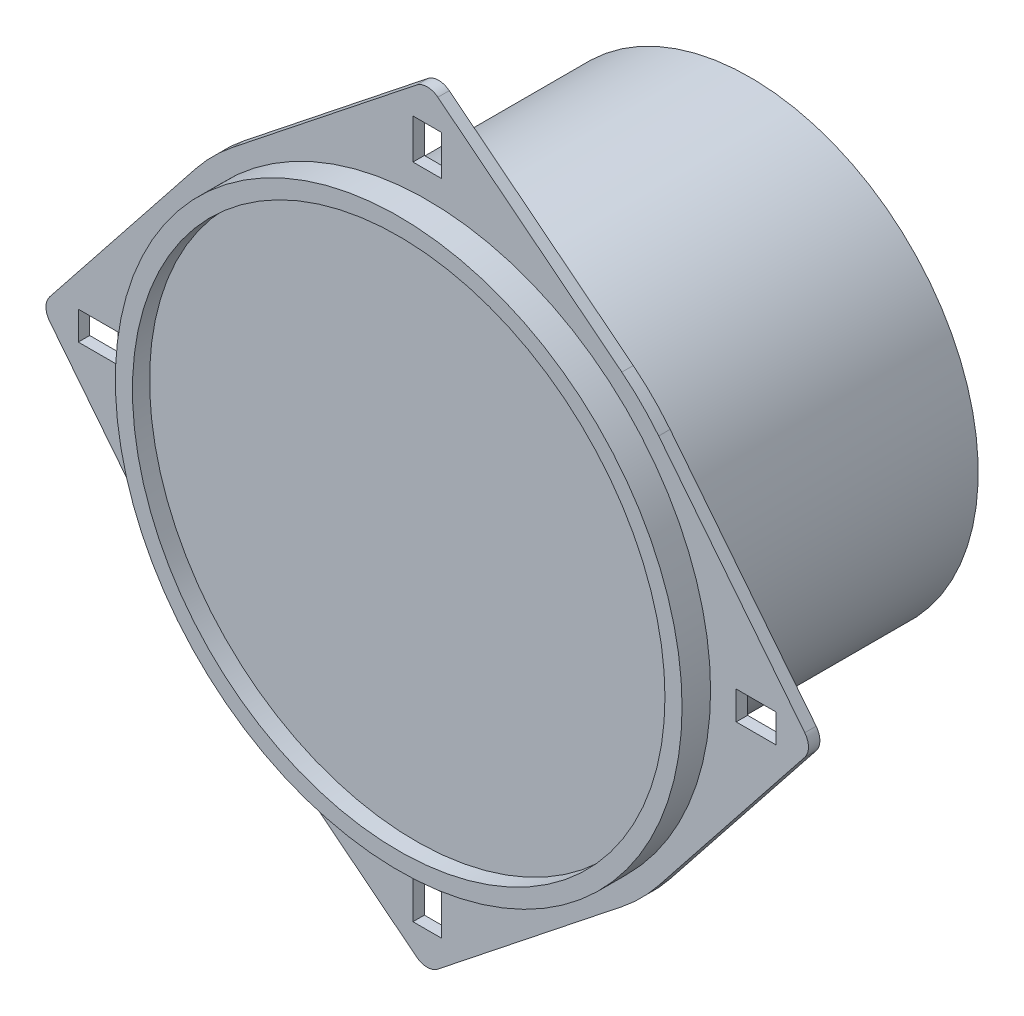
from build123d import *

# Parameters (mm, degrees)
SKETCH1_R           = 49.685
BOSS_EXTRUDE1_DEPTH = 5
SKETCH2_R           = 46.685
CUT_EXTRUDE1_DEPTH  = 3
SKETCH3_W           = 7
SKETCH3_H           = 5
SKETCH3_W_2         = 5
SKETCH3_H_2         = 7
BOSS_EXTRUDE2_DEPTH = 2
SKETCH4_R           = 40
BOSS_EXTRUDE3_DEPTH = 54.61
FILLET2_R           = 3
FILLET3_R           = 40


with BuildPart() as part:
    # Sketch1 → Boss-Extrude1 (new body)
    with BuildSketch(Plane.XY):
        Circle(SKETCH1_R)
    extrude(amount=BOSS_EXTRUDE1_DEPTH)

    # Sketch2 → Cut-Extrude1 (cut)
    with BuildSketch(Plane.XY.offset(5)):
        Circle(SKETCH2_R)
    extrude(amount=-CUT_EXTRUDE1_DEPTH, mode=Mode.SUBTRACT)

    # Sketch3 → Boss-Extrude2 (add)
    with BuildSketch(Plane(origin=(0, 0, 0), x_dir=(-1, 0, 0), z_dir=(0, 0, -1))):
        Polygon((-37.72768231, 37.72768231), (-67.675, 0), (-37.72768231, -37.72768231), (0, -67.675), (37.72768231, -37.72768231), (67.675, 0), (37.72768231, 37.72768231), (0, 67.675), align=None)
        with Locations((-57.675, 0)):
            Rectangle(SKETCH3_W, SKETCH3_H, mode=Mode.SUBTRACT)
        with Locations((0, 57.675)):
            Rectangle(SKETCH3_W_2, SKETCH3_H_2, mode=Mode.SUBTRACT)
        with Locations((57.675, 0)):
            Rectangle(SKETCH3_W, SKETCH3_H, mode=Mode.SUBTRACT)
        with Locations((0, -57.675)):
            Rectangle(SKETCH3_W_2, SKETCH3_H_2, mode=Mode.SUBTRACT)
    extrude(amount=BOSS_EXTRUDE2_DEPTH)

    # Sketch4 → Boss-Extrude3 (add)
    with BuildSketch(Plane(origin=(0, 0, -2), x_dir=(-1, 0, 0), z_dir=(0, 0, -1))):
        Circle(SKETCH4_R)
    extrude(amount=BOSS_EXTRUDE3_DEPTH)

    # Fillet2
    fillet2_edges = [part.edges().sort_by_distance(p)[0] for p in [
        (-67.675, 0, -1),
        (0, 67.675, -1),
        (67.675, 0, -1),
        (0, -67.675, -1),
    ]]
    fillet(fillet2_edges, radius=FILLET2_R)

    # Fillet3
    fillet3_edges = [part.edges().sort_by_distance(p)[0] for p in [
        (-37.72768231, 37.72768231, -1),
        (37.72768231, 37.72768231, -1),
        (37.72768231, -37.72768231, -1),
        (-37.72768231, -37.72768231, -1),
    ]]
    fillet(fillet3_edges, radius=FILLET3_R)


solid = part.part
